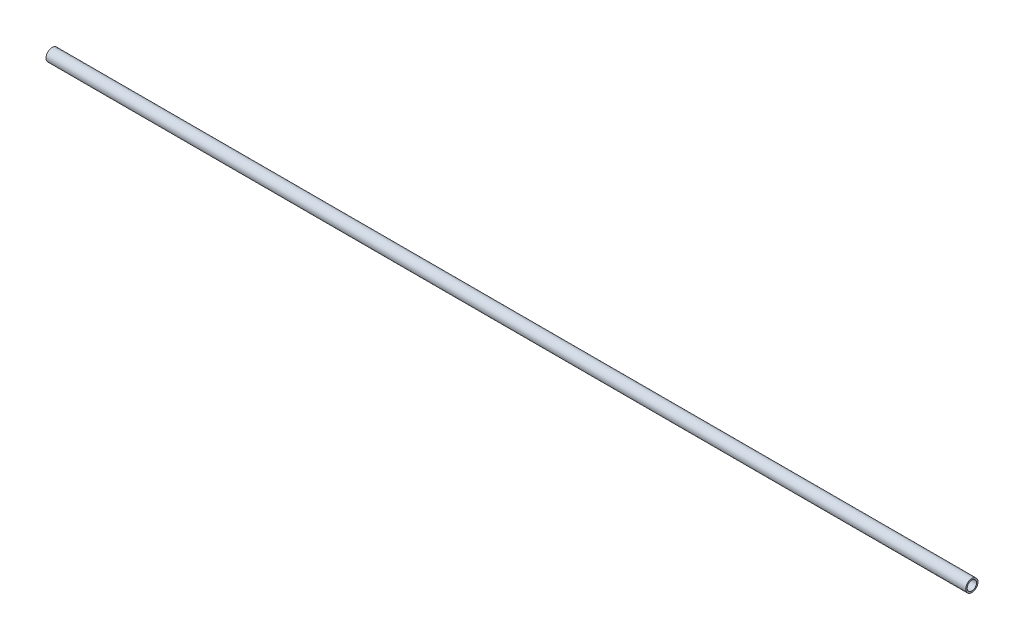
from build123d import *

# Parameters (mm, degrees)
SKETCH1_R           = 12.7
SKETCH1_R_2         = 9.652
BOSS_EXTRUDE1_DEPTH = 1905


with BuildPart() as part:
    # Sketch1 → Boss-Extrude1 (new body)
    with BuildSketch(Plane(origin=(0, 0, 0), x_dir=(0, 0, -1), z_dir=(1, 0, 0))):
        Circle(SKETCH1_R)
        Circle(SKETCH1_R_2, mode=Mode.SUBTRACT)
    extrude(amount=BOSS_EXTRUDE1_DEPTH)


solid = part.part
